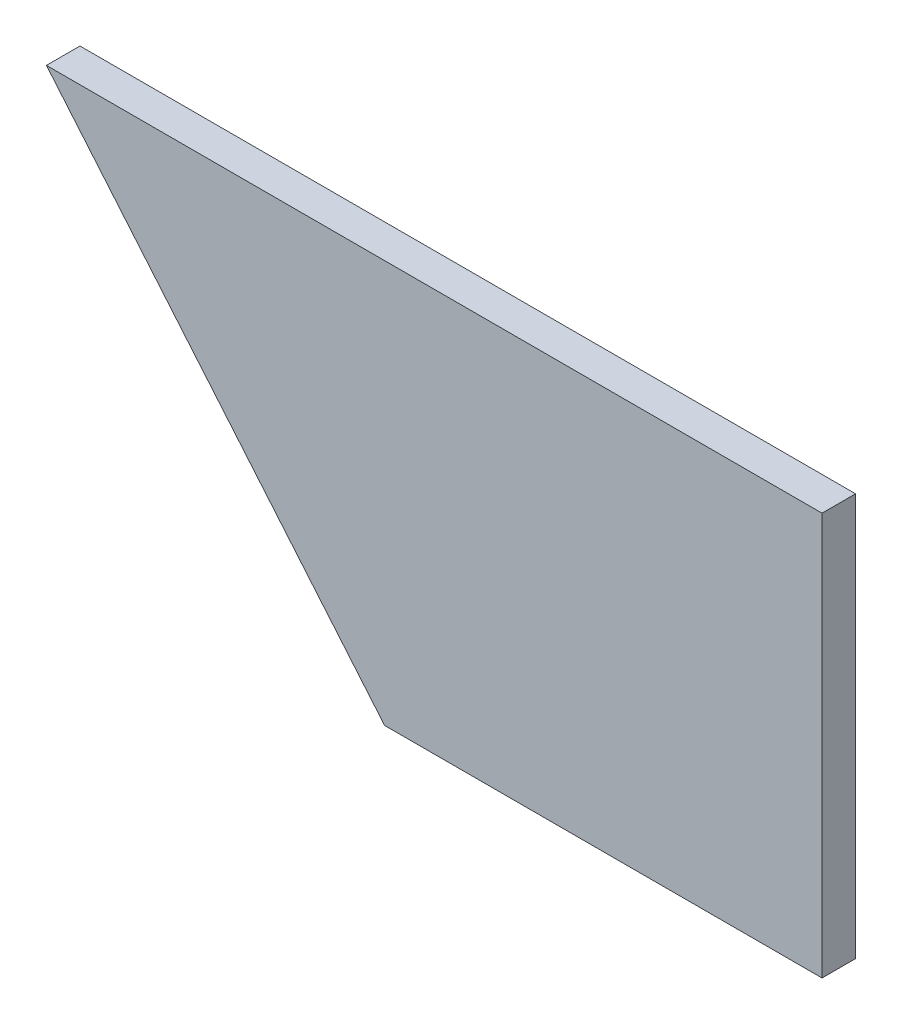
from build123d import *

# Parameters (mm, degrees)
BOSS_EXTRUDE1_DEPTH = 3.175


with BuildPart() as part:
    # Sketch1 → Boss-Extrude1 (new body)
    with BuildSketch(Plane.XY):
        Polygon((12.827, 0), (54.229, 0), (54.229, 38.1), (-19.177, 38.1), align=None)
    extrude(amount=BOSS_EXTRUDE1_DEPTH)


solid = part.part
